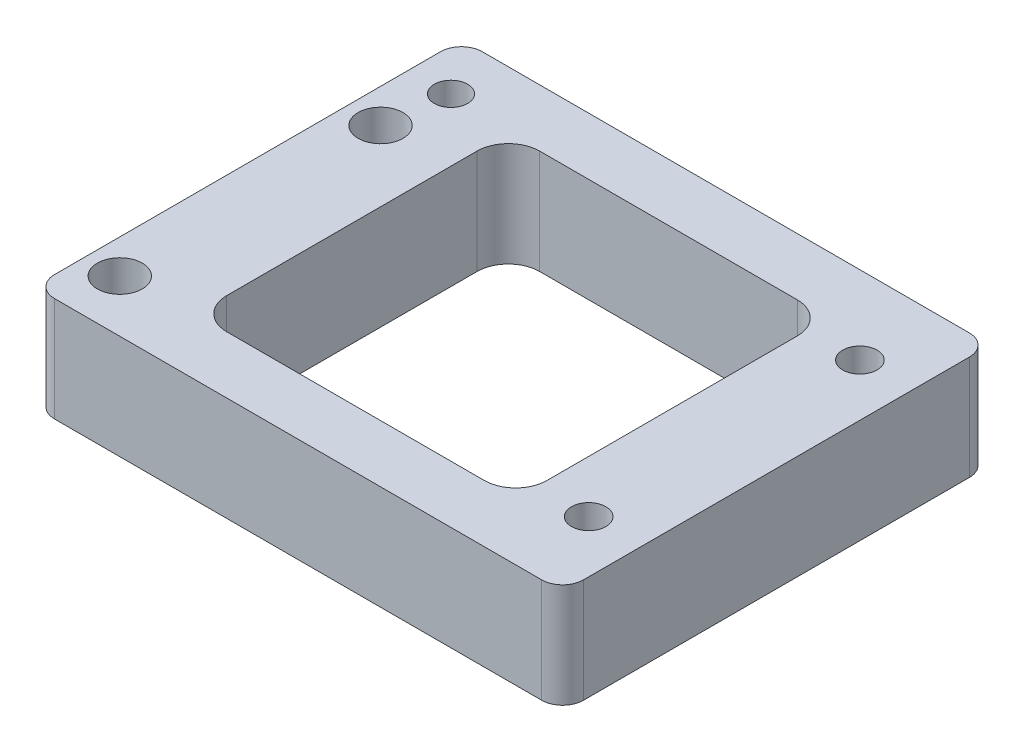
from build123d import *

# Parameters (mm, degrees)
SKETCH_2_W      = 50.7
SKETCH_2_H      = 41
SKETCH_2_R      = 1.6
SKETCH_2_R_2    = 2.15
SKETCH_2_R_3    = 1.65
SKETCH_2_W_2    = 30.7
SKETCH_2_H_2    = 30
EXTRUDE_1_DEPTH = 10
FILLET_1_R      = 2
FILLET_2_R      = 3


with BuildPart() as part:
    # ｽｹｯﾁ2 → ﾎﾞｽ - 押し出し1 (new body)
    with BuildSketch(Plane(origin=(0, 0, 0), x_dir=(1, 0, 0), z_dir=(0, 1, 0))):
        with Locations((25.35, 20.5)):
            Rectangle(SKETCH_2_W, SKETCH_2_H)
        with Locations(Location((4, 36, 0), (0, 0, 270))):
            Circle(SKETCH_2_R, mode=Mode.SUBTRACT)
        with Locations(Location((3.25, 30, 0), (0, 0, 270))):
            Circle(SKETCH_2_R_2, mode=Mode.SUBTRACT)
        with Locations(Location((3.25, 5, 0), (0, 0, 270))):
            Circle(SKETCH_2_R_2, mode=Mode.SUBTRACT)
        with Locations(Location((45.7, 33.5, 0), (0, 0, 270))):
            Circle(SKETCH_2_R_3, mode=Mode.SUBTRACT)
        with Locations(Location((45.7, 7.5, 0), (0, 0, 90))):
            Circle(SKETCH_2_R_3, mode=Mode.SUBTRACT)
        with Locations((25.35, 20.5)):
            Rectangle(SKETCH_2_W_2, SKETCH_2_H_2, mode=Mode.SUBTRACT)
    extrude(amount=EXTRUDE_1_DEPTH)

    # ﾌｨﾚｯﾄ1
    fillet_1_edges = [part.edges().sort_by_distance(p)[0] for p in [
        (0, 5, -41),
        (50.7, 5, -41),
        (50.7, 5, 0),
        (0, 5, 0),
    ]]
    fillet(fillet_1_edges, radius=FILLET_1_R)

    # ﾌｨﾚｯﾄ2
    fillet_2_edges = [part.edges().sort_by_distance(p)[0] for p in [
        (40.7, 5, -5.5),
        (40.7, 5, -35.5),
        (10, 5, -35.5),
        (10, 5, -5.5),
    ]]
    fillet(fillet_2_edges, radius=FILLET_2_R)


solid = part.part
